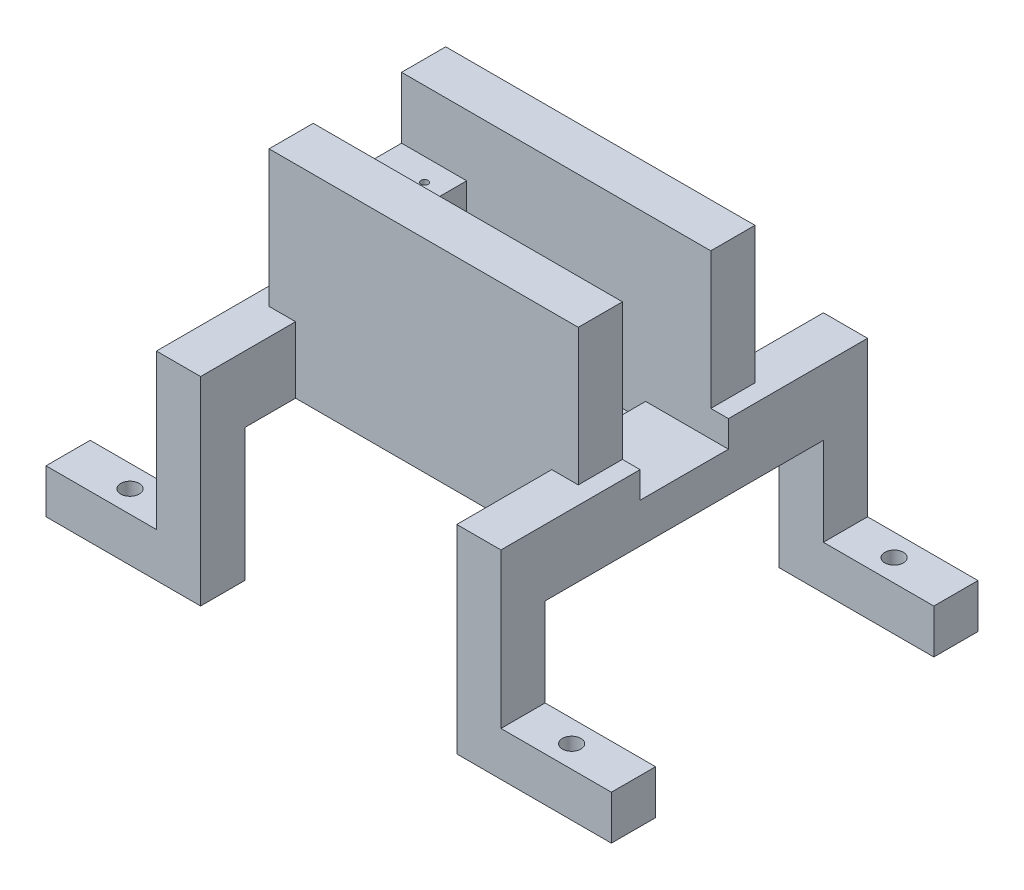
from build123d import *

# Parameters (mm, degrees)
ESQUISSE1_W                          = 70
ESQUISSE1_H                          = 50
BOSS_EXTRU_1_DEPTH                   = 50
ESQUISSE2_W                          = 40.5
ESQUISSE2_H                          = 20
ENL_V_MAT_EXTRU_1_DEPTH              = 38
ESQUISSE3_W                          = 9.502474521
ESQUISSE3_H                          = 20
ENL_V_MAT_EXTRU_2_DEPTH              = 11
ESQUISSE4_R                          = 60.076490873
ESQUISSE4_R_2                        = 49.5
BOSS_EXTRU_2_DEPTH                   = 50
ESQUISSE5_W                          = 60
ESQUISSE5_H                          = 40
ENL_V_MAT_EXTRU_3_DEPTH              = 24
R_P_TITION_CIRCULAIRE1_COUNT         = 5
ESQUISSE12_W                         = 74.3
ESQUISSE12_H                         = 74.3
BOSS_EXTRU_7_DEPTH                   = 28
ESQUISSE13_W                         = 160
ESQUISSE13_H                         = 18
BOSS_EXTRU_8_DEPTH                   = 10
ESQUISSE15_R                         = 60.076490873
BOSS_EXTRU_9_DEPTH                   = 5
ESQUISSE16_W                         = 60
ESQUISSE16_H                         = 70
ENL_V_MAT_EXTRU_4_DEPTH              = 28
ENL_V_MAT_EXTRU_5_REACH              = 156.276
ESQUISSE17_W                         = 60.3
ESQUISSE17_H                         = 28
ENL_V_MAT_EXTRU_6_REACH              = 138.609
ESQUISSE18_W                         = 54.3
ESQUISSE18_H                         = 15.510808694
TROU_TARAUD_M5X0_82_D                = 4.2
TROU_TARAUD_M5X0_82_DEPTH            = 54.927
TROU_TARAUD_M5X0_82_TIP              = 1.2618073
TROU_TARAUD_M5X0_83_D                = 4.2
TROU_TARAUD_M5X0_83_DEPTH            = 54.927
TROU_TARAUD_M5X0_83_TIP              = 1.2618073
CONG_1_R                             = 10
ESQUISSE25_W                         = 16.470730929
ESQUISSE25_H                         = 20
ENL_V_MAT_EXTRU_7_DEPTH              = 34
TROU_TARAUD_M2X0_41_D                = 1.6
TROU_TARAUD_M2X0_41_DEPTH            = 15
TROU_TARAUD_M2X0_41_TIP              = 0.480688495
ESQUISSE28_W                         = 183.397651828
ESQUISSE28_H                         = 123.598647098
ESQUISSE28_W_2                       = 70
ESQUISSE28_H_2                       = 50
ENL_V_MAT_EXTRU_9_DEPTH              = 78
ESQUISSE29_W                         = 76.828034685
ESQUISSE29_H                         = 56.156318878
ENL_V_MAT_EXTRU_10_DEPTH             = 7
ESQUISSE30_W                         = 96.69394631
ESQUISSE30_H                         = 62.030078765
ESQUISSE30_W_2                       = 70
ESQUISSE30_H_2                       = 40
ENL_V_MAT_EXTRU_12_DEPTH             = 43
BOSS_EXTRU_10_DEPTH                  = 15
ESQUISSE35_W                         = 10
ESQUISSE35_H                         = 10
BOSS_EXTRU_12_DEPTH                  = 30
ESQUISSE36_W                         = 10
ESQUISSE36_H                         = 15
BOSS_EXTRU_13_DEPTH                  = 83
ESQUISSE37_W                         = 35
ESQUISSE37_H                         = 10
ESQUISSE37_R                         = 2
BOSS_EXTRU_14_DEPTH                  = 10
ENL_V_MAT_EXTRU_13_REACH             = 119.577
ESQUISSE38_W                         = 51.96710629
ESQUISSE38_H                         = 11.935029196
ENL_V_MAT_EXTRU_13_DIRECTION_2_REACH = 119.577
TROU_TARAUD_M5X0_84_D                = 4.2
ESQUISSE41_W                         = 20
ESQUISSE41_H                         = 6
ENL_V_MAT_EXTRU_14_DEPTH             = 10
ESQUISSE42_W                         = 70
ESQUISSE42_H                         = 10
BOSS_EXTRU_15_DEPTH                  = 13.9


with BuildPart() as part:
    # Esquisse1 → Boss.-Extru.1 (new body)
    with BuildSketch(Plane.XY):
        Rectangle(ESQUISSE1_W, ESQUISSE1_H)
    extrude(amount=BOSS_EXTRU_1_DEPTH)

    # Esquisse2 → Enlèv. mat.-Extru.1 (cut)
    with BuildSketch(Plane(origin=(0, 25, 0), x_dir=(1, 0, 0), z_dir=(0, 1, 0))):
        with Locations((0, -25)):
            Rectangle(ESQUISSE2_W, ESQUISSE2_H)
    extrude(amount=-ENL_V_MAT_EXTRU_1_DEPTH, mode=Mode.SUBTRACT)

    # Esquisse3 → Enlèv. mat.-Extru.2 (cut)
    with BuildSketch(Plane(origin=(0, 25, 0), x_dir=(1, 0, 0), z_dir=(0, 1, 0))):
        with Locations((25.001237261, -25)):
            Rectangle(ESQUISSE3_W, ESQUISSE3_H)
        with Locations((-25.001237261, -25)):
            Rectangle(ESQUISSE3_W, ESQUISSE3_H)
    extrude(amount=-ENL_V_MAT_EXTRU_2_DEPTH, mode=Mode.SUBTRACT)

    # Esquisse4 → Boss.-Extru.2 (add)
    # profile 1 of 7: a face of its own
    with BuildSketch(Plane(origin=(0, 25, 0), x_dir=(1, 0, 0), z_dir=(0, 1, 0))):
        with Locations(Location((0, -25.176679726, 0), (0, 0, 270))):
            Circle(ESQUISSE4_R)
        with Locations(Location((0, -25.176679726, 0), (0, 0, 270))):
            Circle(ESQUISSE4_R_2, mode=Mode.SUBTRACT)
    # profile 2 of 7: a face of its own
    with BuildSketch(Plane(origin=(0, 25, 0), x_dir=(1, 0, 0), z_dir=(0, 1, 0))):
        with BuildLine():
            ThreePointArc((24.673928965, -50), (32.315534297, -38.619381951), (35, -25.176679726))
            ThreePointArc((35, -25.176679726), (32.217729855, -11.501231543), (24.313263828, 0))
            Line((24.313263828, 0), (20.744399349, 0))
            ThreePointArc((20.744399349, 0), (29.503552635, -11.257782921), (32.622006474, -25.176679726))
            ThreePointArc((32.622006474, -25.176679726), (29.619854452, -38.846336948), (21.16596506, -50))
            Line((21.16596506, -50), (24.673928965, -50))
        make_face()
    # profile 3 of 7: a face of its own
    with BuildSketch(Plane(origin=(0, 25, 0), x_dir=(1, 0, 0), z_dir=(0, 1, 0))):
        with BuildLine():
            Line((-20.744399349, 0), (-24.313263828, 0))
            ThreePointArc((-24.313263828, 0), (-34.99908948, -24.924220698), (-24.673928965, -50))
            Line((-24.673928965, -50), (-21.16596506, -50))
            ThreePointArc((-21.16596506, -50), (-32.620847034, -24.901643114), (-20.744399349, 0))
        make_face()
    # profile 4 of 7: a face of its own
    with BuildSketch(Plane(origin=(0, 25, 0), x_dir=(1, 0, 0), z_dir=(0, 1, 0))):
        with BuildLine():
            Line((20.744399349, 0), (24.313263828, 0))
            ThreePointArc((24.313263828, 0), (0, 9.823320274), (-24.313263828, 0))
            Line((-24.313263828, 0), (-20.744399349, 0))
            ThreePointArc((-20.744399349, 0), (0, 7.445326748), (20.744399349, 0))
        make_face()
    # profile 5 of 7: a face of its own
    with BuildSketch(Plane(origin=(0, 25, 0), x_dir=(1, 0, 0), z_dir=(0, 1, 0))):
        with BuildLine():
            ThreePointArc((24.673928965, -50), (32.315534297, -38.619381951), (35, -25.176679726))
            ThreePointArc((35, -25.176679726), (32.217729855, -11.501231543), (24.313263828, 0))
            Line((24.313263828, 0), (20.744399349, 0))
            ThreePointArc((20.744399349, 0), (29.503552635, -11.257782921), (32.622006474, -25.176679726))
            ThreePointArc((32.622006474, -25.176679726), (29.619854452, -38.846336948), (21.16596506, -50))
            Line((21.16596506, -50), (24.673928965, -50))
        make_face()
    # profile 6 of 7: a face of its own
    with BuildSketch(Plane(origin=(0, 25, 0), x_dir=(1, 0, 0), z_dir=(0, 1, 0))):
        with BuildLine():
            Line((-20.744399349, 0), (-24.313263828, 0))
            ThreePointArc((-24.313263828, 0), (-34.99908948, -24.924220698), (-24.673928965, -50))
            Line((-24.673928965, -50), (-21.16596506, -50))
            ThreePointArc((-21.16596506, -50), (-32.620847034, -24.901643114), (-20.744399349, 0))
        make_face()
    # profile 7 of 7: a face of its own
    with BuildSketch(Plane(origin=(0, 25, 0), x_dir=(1, 0, 0), z_dir=(0, 1, 0))):
        with BuildLine():
            ThreePointArc((-24.673928965, -50), (0, -60.176679726), (24.673928965, -50))
            Line((24.673928965, -50), (21.16596506, -50))
            ThreePointArc((21.16596506, -50), (0, -57.798686199), (-21.16596506, -50))
            Line((-21.16596506, -50), (-24.673928965, -50))
        make_face()
    extrude(amount=-BOSS_EXTRU_2_DEPTH)


with BuildPart() as boss_extru_2_piece_1:
    # of the separate pieces the step leaves, piece 1, a body of its own (boss_extru_2_pieces)
    add(part.part.solids().sort_by_distance((0, 25, 85.253170599))[0])

    # Esquisse5 → Enlèv. mat.-Extru.3 (cut)
    with BuildSketch(Plane(origin=(60.076490873, 0, 0), x_dir=(0, 0, -1), z_dir=(1, 0, 0))):
        with Locations((-25.176679726, 0)):
            Rectangle(ESQUISSE5_W, ESQUISSE5_H)
    enl_v_mat_extru_3 = extrude(amount=-ENL_V_MAT_EXTRU_3_DEPTH, mode=Mode.SUBTRACT)

    # Répétition circulaire1: Enlèv. mat.-Extru.3 ×5 about axis
    r_p_tition_circulaire1_axis = Axis((0, 0, 25.176679726), (0, 1, 0))
    for i in range(1, R_P_TITION_CIRCULAIRE1_COUNT):
        add(enl_v_mat_extru_3.rotate(r_p_tition_circulaire1_axis, i * 360 / R_P_TITION_CIRCULAIRE1_COUNT), mode=Mode.SUBTRACT)



with BuildPart() as boss_extru_2_piece_2:
    # of the separate pieces the step leaves, piece 2, a body of its own (boss_extru_2_pieces)
    add(part.part.solids().sort_by_distance((-35, 25, 0))[0])


with BuildPart() as boss_extru_2_piece_1_1:
    add(boss_extru_2_piece_1.part)

    add(boss_extru_2_piece_2.part)  # Boss.-Extru.7 merges Boss.-Extru.2 piece 2
    # Esquisse12 → Boss.-Extru.7 (add)
    with BuildSketch(Plane.XZ.offset(25)):
        with Locations((0, 25.176679726)):
            Rectangle(ESQUISSE12_W, ESQUISSE12_H)
    extrude(amount=BOSS_EXTRU_7_DEPTH)

    # Esquisse13 → Boss.-Extru.8 (add)
    with BuildSketch(Plane.XZ.offset(53)):
        with Locations((0, 71.326679726)):
            Rectangle(ESQUISSE13_W, ESQUISSE13_H)
        with Locations((0, -20.973320274)):
            Rectangle(ESQUISSE13_W, ESQUISSE13_H)
    extrude(amount=-BOSS_EXTRU_8_DEPTH)

    # Esquisse15 → Boss.-Extru.9 (add)
    with BuildSketch(Plane(origin=(0, -20, 0), x_dir=(1, 0, 0), z_dir=(0, 1, 0))):
        with Locations(Location((0, -25.176679726, 0), (0, 0, 270))):
            Circle(ESQUISSE15_R)
    extrude(amount=-BOSS_EXTRU_9_DEPTH)

    # Esquisse16 → Enlèv. mat.-Extru.4 (cut)
    with BuildSketch(Plane.XZ.offset(53)):
        with Locations((3.15, 25.176679726)):
            Rectangle(ESQUISSE16_W, ESQUISSE16_H)
    extrude(amount=-ENL_V_MAT_EXTRU_4_DEPTH, mode=Mode.SUBTRACT)

    # Enlèv. mat.-Extru.5: up to this face of the body (flat: up to its plane)
    enl_v_mat_extru_5_end = Plane(boss_extru_2_piece_1_1.part.faces().sort_by_distance((-37.15, -39, 25.176679726))[0])
    # Esquisse17 → Enlèv. mat.-Extru.5 (cut, up to the picked face)
    with BuildSketch(Plane(origin=(37.15, 0, 0), x_dir=(0, 0, -1), z_dir=(1, 0, 0)), mode=Mode.PRIVATE) as enl_v_mat_extru_5_sk1:
        with Locations((-25.176679726, -39)):
            Rectangle(ESQUISSE17_W, ESQUISSE17_H)
    enl_v_mat_extru_5_tool1 = split(extrude(enl_v_mat_extru_5_sk1.sketch, amount=-ENL_V_MAT_EXTRU_5_REACH, mode=Mode.PRIVATE), bisect_by=enl_v_mat_extru_5_end, keep=Keep.BOTH, mode=Mode.PRIVATE)
    add(enl_v_mat_extru_5_tool1.solids().sort_by(Axis((37.15, -39, 25.17668), (-1, 0, 0)))[0], mode=Mode.SUBTRACT)

    # Enlèv. mat.-Extru.6: up to this face of the body (flat: up to its plane)
    enl_v_mat_extru_6_end = Plane(boss_extru_2_piece_1_1.part.faces().sort_by_distance((0, -34, -11.973320274))[0])
    # Esquisse18 → Enlèv. mat.-Extru.6 (cut, up to the picked face)
    with BuildSketch(Plane.XY.offset(62.326679726), mode=Mode.PRIVATE) as enl_v_mat_extru_6_sk1:
        with Locations((0, -35.244595653)):
            Rectangle(ESQUISSE18_W, ESQUISSE18_H)
    enl_v_mat_extru_6_tool1 = split(extrude(enl_v_mat_extru_6_sk1.sketch, amount=-ENL_V_MAT_EXTRU_6_REACH, mode=Mode.PRIVATE), bisect_by=enl_v_mat_extru_6_end, keep=Keep.BOTH, mode=Mode.PRIVATE)
    add(enl_v_mat_extru_6_tool1.solids().sort_by(Axis((0, -35.244596, 62.32668), (0, 0, -1)))[0], mode=Mode.SUBTRACT)

    # Trou taraudé M5x0.82
    with Locations(Plane(origin=(-57.931903984, -53, -18.999181229), x_dir=(0, 0, -1), z_dir=(0, -1, 0))):
        with Locations((0, 0), (-88.38422, 0.087735642)):
            Hole(TROU_TARAUD_M5X0_82_D / 2, depth=TROU_TARAUD_M5X0_82_DEPTH)
            with Locations((0, 0, -(TROU_TARAUD_M5X0_82_DEPTH + TROU_TARAUD_M5X0_82_TIP / 2))):  # 118° drill point
                Cone(0, TROU_TARAUD_M5X0_82_D / 2, TROU_TARAUD_M5X0_82_TIP, mode=Mode.SUBTRACT)

    # Trou taraudé M5x0.83
    with Locations(Plane(origin=(67.121659864, -53, 69.376817601), x_dir=(0, 0, -1), z_dir=(0, -1, 0))):
        with Locations((0, 0), (88.384296015, 0.049521474)):
            Hole(TROU_TARAUD_M5X0_83_D / 2, depth=TROU_TARAUD_M5X0_83_DEPTH)
            with Locations((0, 0, -(TROU_TARAUD_M5X0_83_DEPTH + TROU_TARAUD_M5X0_83_TIP / 2))):  # 118° drill point
                Cone(0, TROU_TARAUD_M5X0_83_D / 2, TROU_TARAUD_M5X0_83_TIP, mode=Mode.SUBTRACT)

    # Congé1
    cong_1_edges = [boss_extru_2_piece_1_1.edges().sort_by_distance(p)[0] for p in [
        (-32.15, -43, 62.326679726),
        (32.15, -43, -11.973320274),
        (32.15, -43, 62.326679726),
        (-32.15, -43, -11.973320274),
    ]]
    fillet(cong_1_edges, radius=CONG_1_R)

    # Esquisse25 → Enlèv. mat.-Extru.7 (cut)
    with BuildSketch(Plane(origin=(0, 25, 0), x_dir=(1, 0, 0), z_dir=(0, 1, 0))):
        with Locations((26.764634536, -25)):
            Rectangle(ESQUISSE25_W, ESQUISSE25_H)
    extrude(amount=-ENL_V_MAT_EXTRU_7_DEPTH, mode=Mode.SUBTRACT)

    # Trou taraudé M2x0.41
    with Locations(Plane(origin=(-24.71, 14, 20.075), x_dir=(0, 0, 1), z_dir=(0, 1, 0))):
        with Locations((0, 0), (9.85, 0)):
            Hole(TROU_TARAUD_M2X0_41_D / 2, depth=TROU_TARAUD_M2X0_41_DEPTH)
            with Locations((0, 0, -(TROU_TARAUD_M2X0_41_DEPTH + TROU_TARAUD_M2X0_41_TIP / 2))):  # 118° drill point
                Cone(0, TROU_TARAUD_M2X0_41_D / 2, TROU_TARAUD_M2X0_41_TIP, mode=Mode.SUBTRACT)

    # Esquisse28 → Enlèv. mat.-Extru.9 (cut)
    with BuildSketch(Plane(origin=(0, 25, 0), x_dir=(1, 0, 0), z_dir=(0, 1, 0))):
        with Locations((-1.368639193, -26.124199167)):
            Rectangle(ESQUISSE28_W, ESQUISSE28_H)
        with Locations((0, -25)):
            Rectangle(ESQUISSE28_W_2, ESQUISSE28_H_2, mode=Mode.SUBTRACT)
    extrude(amount=-ENL_V_MAT_EXTRU_9_DEPTH, mode=Mode.SUBTRACT)

    # Esquisse29 → Enlèv. mat.-Extru.10 (cut)
    with BuildSketch(Plane.XZ.offset(25)):
        with Locations((-0.165815903, 24.336736391)):
            Rectangle(ESQUISSE29_W, ESQUISSE29_H)
    extrude(amount=-ENL_V_MAT_EXTRU_10_DEPTH, mode=Mode.SUBTRACT)

    # Esquisse30 → Enlèv. mat.-Extru.12 (cut)
    with BuildSketch(Plane(origin=(0, 25, 0), x_dir=(1, 0, 0), z_dir=(0, 1, 0))):
        with Locations((-2.735660047, -26.938439962)):
            Rectangle(ESQUISSE30_W, ESQUISSE30_H)
        with Locations((0, -25)):
            Rectangle(ESQUISSE30_W_2, ESQUISSE30_H_2, mode=Mode.SUBTRACT)
    extrude(amount=-ENL_V_MAT_EXTRU_12_DEPTH, mode=Mode.SUBTRACT)

    # Esquisse32 → Boss.-Extru.10 (add)
    with BuildSketch(Plane.XZ.offset(18)):
        with BuildLine():
            Line((-39, 66.5), (-29, 66.5))
            Line((-29, 66.5), (-29, 45))
            ThreePointArc((-29, 45), (-31.944624802, 42.375028916), (-35, 39.879839382))
            Line((-35, 39.879839382), (-39, 45))
            Line((-39, 45), (-39, 66.5))
        make_face()
        with BuildLine():
            Line((29, 66.5), (29, 45))
            ThreePointArc((29, 45), (31.944624802, 42.375028916), (35, 39.879839382))
            Line((35, 39.879839382), (39, 45))
            Line((39, 45), (39, 66.5))
            Line((39, 66.5), (29, 66.5))
        make_face()
        with BuildLine():
            Line((39, -16.5), (39, 5))
            Line((39, 5), (35, 10.120160618))
            ThreePointArc((35, 10.120160618), (31.944624802, 7.624971084), (29, 5))
            Line((29, 5), (29, -16.5))
            Line((29, -16.5), (39, -16.5))
        make_face()
        with BuildLine():
            Line((-39, 5), (-35, 10.120160618))
            ThreePointArc((-35, 10.120160618), (-31.944624802, 7.624971084), (-29, 5))
            Line((-29, 5), (-29, -16.5))
            Line((-29, -16.5), (-39, -16.5))
            Line((-39, -16.5), (-39, 5))
        make_face()
    extrude(amount=-BOSS_EXTRU_10_DEPTH)

    # Esquisse35 → Boss.-Extru.12 (add)
    with BuildSketch(Plane.XZ.offset(18)):
        with Locations((-34, 61.5)):
            Rectangle(ESQUISSE35_W, ESQUISSE35_H)
        with Locations((-34, -11.5)):
            Rectangle(ESQUISSE35_W, ESQUISSE35_H)
        with Locations((34, -11.5)):
            Rectangle(ESQUISSE35_W, ESQUISSE35_H)
        with Locations((34, 61.5)):
            Rectangle(ESQUISSE35_W, ESQUISSE35_H)
    extrude(amount=BOSS_EXTRU_12_DEPTH)

    # Esquisse36 → Boss.-Extru.13 (add)
    with BuildSketch(Plane.XY.offset(66.5)):
        with Locations((-34, -10.5)):
            Rectangle(ESQUISSE36_W, ESQUISSE36_H)
        with Locations((34, -10.5)):
            Rectangle(ESQUISSE36_W, ESQUISSE36_H)
    extrude(amount=-BOSS_EXTRU_13_DEPTH)

    # Esquisse37 → Boss.-Extru.14 (add)
    # profile 1 of 4: a face of its own
    with BuildSketch(Plane.XZ.offset(48)):
        with Locations((-46.5, -11.5)):
            Rectangle(ESQUISSE37_W, ESQUISSE37_H)
        with Locations(Location((-50, -11.5, 0), (0, 0, 90))):
            Circle(ESQUISSE37_R, mode=Mode.SUBTRACT)
    # profile 2 of 4: a face of its own
    with BuildSketch(Plane.XZ.offset(48)):
        with Locations((-46.5, 61.5)):
            Rectangle(ESQUISSE37_W, ESQUISSE37_H)
        with Locations(Location((-50, 61.5, 0), (0, 0, 270))):
            Circle(ESQUISSE37_R, mode=Mode.SUBTRACT)
    # profile 3 of 4: a face of its own
    with BuildSketch(Plane.XZ.offset(48)):
        with Locations((46.5, -11.5)):
            Rectangle(ESQUISSE37_W, ESQUISSE37_H)
        with Locations(Location((50, -11.5, 0), (0, 0, 270))):
            Circle(ESQUISSE37_R, mode=Mode.SUBTRACT)
    # profile 4 of 4: a face of its own
    with BuildSketch(Plane.XZ.offset(48)):
        with Locations((46.5, 61.5)):
            Rectangle(ESQUISSE37_W, ESQUISSE37_H)
        with Locations(Location((50, 61.5, 0), (0, 0, 90))):
            Circle(ESQUISSE37_R, mode=Mode.SUBTRACT)
    extrude(amount=-BOSS_EXTRU_14_DEPTH)

    # Enlèv. mat.-Extru.13: up to this face of the body (flat: up to its plane)
    enl_v_mat_extru_13_end = Plane(boss_extru_2_piece_1_1.part.faces().sort_by_distance((-35, 11, 25))[0])
    # Esquisse38 → Enlèv. mat.-Extru.13 (cut, up to the picked face)
    with BuildSketch(Plane(origin=(-20.25, 0, 0), x_dir=(0, 0, -1), z_dir=(1, 0, 0)), mode=Mode.PRIVATE) as enl_v_mat_extru_13_sk1:
        with Locations((-27.486464416, 19.967514598)):
            Rectangle(ESQUISSE38_W, ESQUISSE38_H)
    enl_v_mat_extru_13_tool1 = split(extrude(enl_v_mat_extru_13_sk1.sketch, amount=-ENL_V_MAT_EXTRU_13_REACH, mode=Mode.PRIVATE), bisect_by=enl_v_mat_extru_13_end, keep=Keep.BOTH, mode=Mode.PRIVATE)
    add(enl_v_mat_extru_13_tool1.solids().sort_by(Axis((-20.25, 19.967515, 27.486464), (-1, 0, 0)))[0], mode=Mode.SUBTRACT)

    # Enlèv. mat.-Extru.13 direction 2: up to this face of the body (flat: up to its plane)
    enl_v_mat_extru_13_direction_2_end = Plane(boss_extru_2_piece_1_1.part.faces().sort_by_distance((35, 11, 40))[0])
    # Esquisse38 → Enlèv. mat.-Extru.13 direction 2 (cut, up to the picked face)
    with BuildSketch(Plane(origin=(-20.25, 0, 0), x_dir=(0, 0, -1), z_dir=(1, 0, 0)), mode=Mode.PRIVATE) as enl_v_mat_extru_13_direction_2_sk1:
        with Locations((-27.486464416, 19.967514598)):
            Rectangle(ESQUISSE38_W, ESQUISSE38_H)
    enl_v_mat_extru_13_direction_2_tool1 = split(extrude(enl_v_mat_extru_13_direction_2_sk1.sketch, amount=ENL_V_MAT_EXTRU_13_DIRECTION_2_REACH, mode=Mode.PRIVATE), bisect_by=enl_v_mat_extru_13_direction_2_end, keep=Keep.BOTH, mode=Mode.PRIVATE)
    add(enl_v_mat_extru_13_direction_2_tool1.solids().sort_by(Axis((-20.25, 19.967515, 27.486464), (1, 0, 0)))[0], mode=Mode.SUBTRACT)

    # Trou taraudé M5x0.84 (through all)
    with Locations(Plane(origin=(-50, -38, -11.5), x_dir=(0, 0, 1), z_dir=(0, 1, 0))):
        with Locations((0, 0), (0, 100), (73, 100), (73, 0)):
            Hole(TROU_TARAUD_M5X0_84_D / 2)

    # Esquisse41 → Enlèv. mat.-Extru.14 (cut)
    with BuildSketch(Plane.ZY.offset(-29)):
        with Locations((25, -6)):
            Rectangle(ESQUISSE41_W, ESQUISSE41_H)
    extrude(amount=-ENL_V_MAT_EXTRU_14_DEPTH, mode=Mode.SUBTRACT)

    # Esquisse42 → Boss.-Extru.15 (add)
    with BuildSketch(Plane(origin=(0, 14, 0), x_dir=(1, 0, 0), z_dir=(0, 1, 0))):
        with Locations((0, -10)):
            Rectangle(ESQUISSE42_W, ESQUISSE42_H)
        with Locations((0, -40)):
            Rectangle(ESQUISSE42_W, ESQUISSE42_H)
    extrude(amount=BOSS_EXTRU_15_DEPTH)


solid = boss_extru_2_piece_1_1.part
